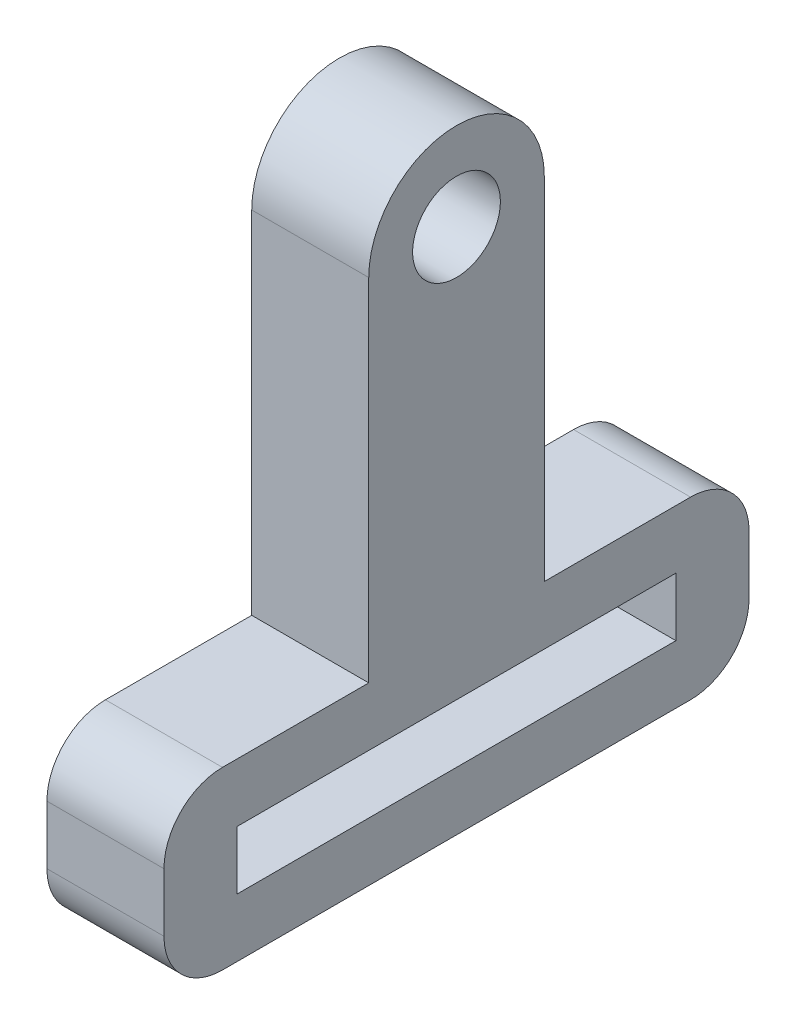
from build123d import *

# Parameters (mm, degrees)
CROQUIS1_R              = 1.5
CROQUIS1_W              = 15
CROQUIS1_H              = 2
SALIENTE_EXTRUIR1_DEPTH = 2


with BuildPart() as part:
    # Croquis1 → Saliente-Extruir1 (new, symmetric)
    with BuildSketch(Plane(origin=(0, 0, 0), x_dir=(0, 0, -1), z_dir=(1, 0, 0))):
        with BuildLine():
            Line((-10, 1), (-10, -1))
            ThreePointArc((-10, -1), (-9.414213562, -2.414213562), (-8, -3))
            Line((-8, -3), (8, -3))
            ThreePointArc((8, -3), (9.414213562, -2.414213562), (10, -1))
            Line((10, -1), (10, 1))
            ThreePointArc((10, 1), (9.414213562, 2.414213562), (8, 3))
            Line((8, 3), (3, 3))
            Line((3, 3), (3, 15))
            ThreePointArc((3, 15), (0, 18), (-3, 15))
            Line((-3, 15), (-3, 3))
            Line((-3, 3), (-8, 3))
            ThreePointArc((-8, 3), (-9.414213562, 2.414213562), (-10, 1))
        make_face()
        with Locations((0, 15)):
            Circle(CROQUIS1_R, mode=Mode.SUBTRACT)
        Rectangle(CROQUIS1_W, CROQUIS1_H, mode=Mode.SUBTRACT)
    extrude(amount=SALIENTE_EXTRUIR1_DEPTH, both=True)


solid = part.part
